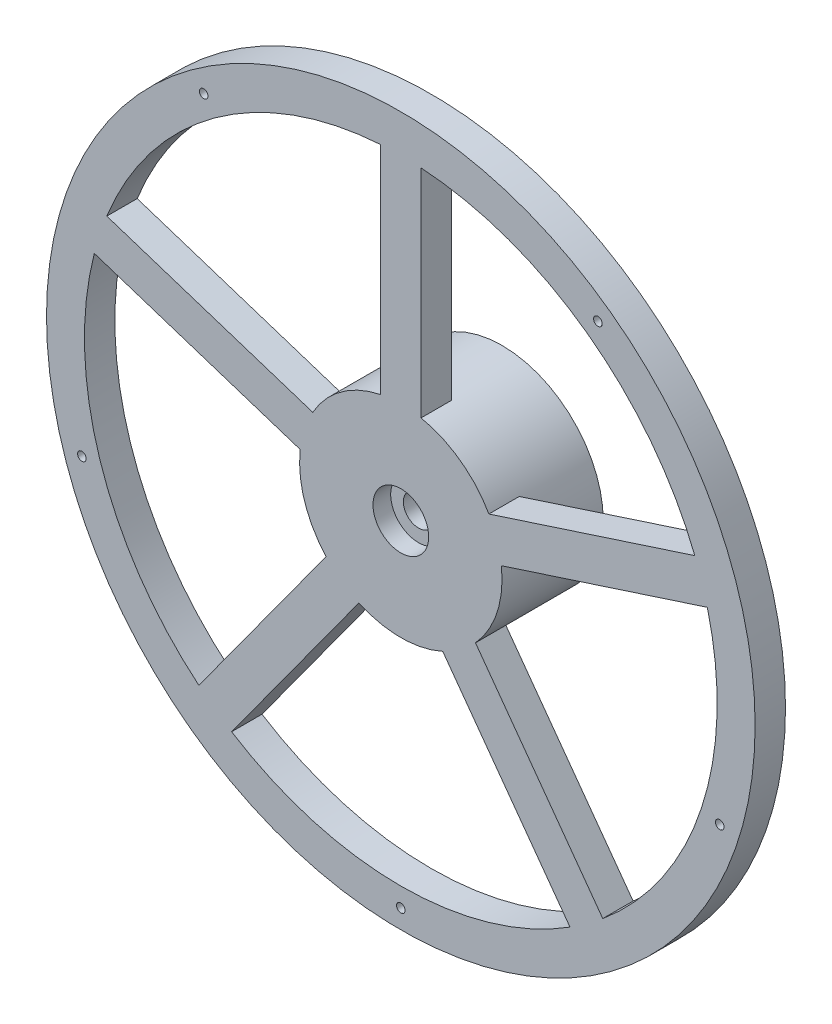
from build123d import *

# Parameters (mm, degrees)
SKETCH1_R               = 140
SKETCH1_R_2             = 125
RING_DEPTH              = 12
SKETCH2_R               = 40
HUB_DEPTH               = 40
SKETCH3_W               = 16
SKETCH3_H               = 87
SPOKES_DEPTH            = 12
SKETCH4_R               = 6
BORE_DEPTH              = 40
SKETCH5_R               = 11
BEARING_SEAT_LOW_DEPTH  = 7
SKETCH6_R               = 11
BEARING_SEAT_HIGH_DEPTH = 7
SKETCH7_R               = 1.7
RING_SCREWS_DEPTH       = 12
SKETCH8_R               = 1.25
GROMMET_SCREWS_DEPTH    = 8


with BuildPart() as part:
    # Sketch1 → Ring (new body)
    with BuildSketch(Plane.XY.offset(28)):
        Circle(SKETCH1_R)
        Circle(SKETCH1_R_2, mode=Mode.SUBTRACT)
    extrude(amount=RING_DEPTH)



with BuildPart() as body_2:
    # Sketch2 → Hub (new body)
    with BuildSketch(Plane.XY):
        Circle(SKETCH2_R)
    extrude(amount=HUB_DEPTH)


with BuildPart() as part_1:
    add(part.part)

    add(body_2.part)  # Spokes merges body 2
    # Sketch3 → Spokes (add)
    with BuildSketch(Plane.XY.offset(28)):
        Polygon((39.563340091, 4.44321065), (122.305257008, 31.327689161), (117.360985098, 46.544593422), (34.619068181, 19.660114911), align=None)
        with Locations((0, 82.5)):
            Rectangle(SKETCH3_W, SKETCH3_H)
        Polygon((-34.619068181, 19.660114911), (-117.360985098, 46.544593422), (-122.305257008, 31.327689161), (-39.563340091, 4.44321065), align=None)
        Polygon((-29.395760794, -26.849380762), (-80.533077744, -97.233859273), (-67.588805834, -106.63842331), (-16.451488884, -36.253944799), align=None)
        Polygon((16.451488884, -36.253944799), (67.588805834, -106.63842331), (80.533077744, -97.233859273), (29.395760794, -26.849380762), align=None)
    extrude(amount=SPOKES_DEPTH)

    # Sketch4 → Bore (cut)
    with BuildSketch(Plane.XY):
        Circle(SKETCH4_R)
    extrude(amount=BORE_DEPTH, mode=Mode.SUBTRACT)

    # Sketch5 → Bearing_seat_low (cut)
    with BuildSketch(Plane.XY):
        Circle(SKETCH5_R)
    extrude(amount=BEARING_SEAT_LOW_DEPTH, mode=Mode.SUBTRACT)

    # Sketch6 → Bearing_seat_high (cut)
    with BuildSketch(Plane.XY.offset(33)):
        Circle(SKETCH6_R)
    extrude(amount=BEARING_SEAT_HIGH_DEPTH, mode=Mode.SUBTRACT)

    # Sketch7 → Ring_screws (cut)
    with BuildSketch(Plane.XY.offset(28)):
        with Locations((77.881545929, 107.194751755)):
            Circle(SKETCH7_R)
        with Locations((-77.881545929, 107.194751755)):
            Circle(SKETCH7_R)
        with Locations((-126.014988409, -40.944751755)):
            Circle(SKETCH7_R)
        with Locations((0, -132.5)):
            Circle(SKETCH7_R)
        with Locations((126.014988409, -40.944751755)):
            Circle(SKETCH7_R)
    extrude(amount=RING_SCREWS_DEPTH, mode=Mode.SUBTRACT)

    # Sketch8 → Grommet_screws (cut)
    with BuildSketch(Plane.XY):
        with Locations((21.213203436, 21.213203436)):
            Circle(SKETCH8_R)
        with Locations((-21.213203436, 21.213203436)):
            Circle(SKETCH8_R)
        with Locations((-21.213203436, -21.213203436)):
            Circle(SKETCH8_R)
        with Locations((21.213203436, -21.213203436)):
            Circle(SKETCH8_R)
    extrude(amount=GROMMET_SCREWS_DEPTH, mode=Mode.SUBTRACT)


solid = part_1.part
